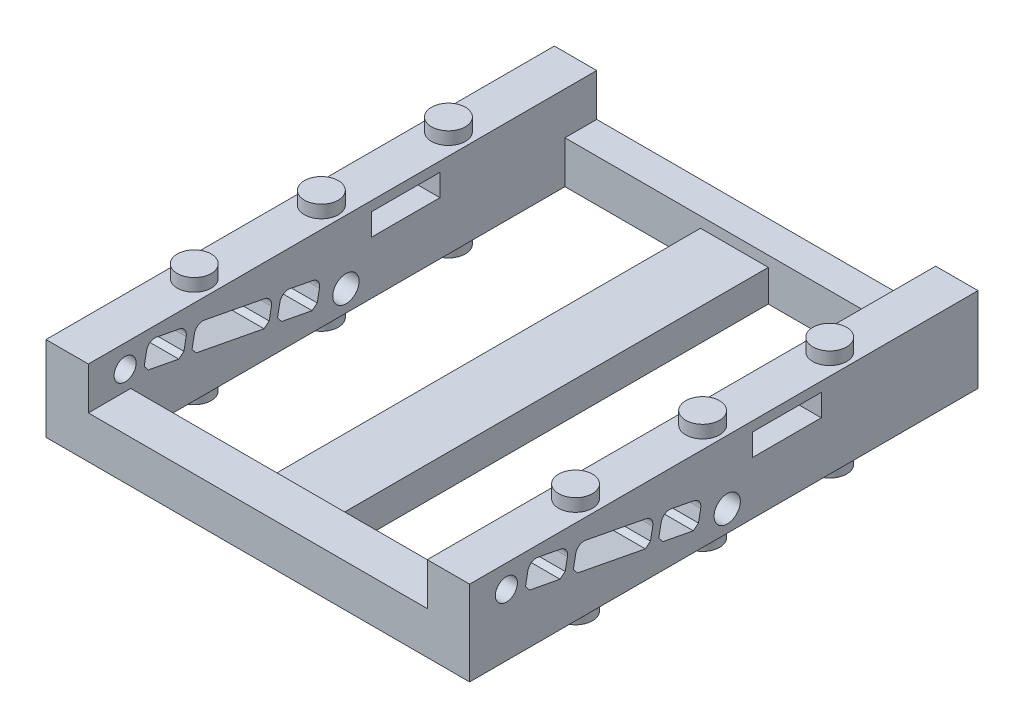
from build123d import *

# Parameters (mm, degrees)
SKETCH1_W               = 100
SKETCH1_H               = 120
SKETCH1_W_2             = 80
SKETCH1_H_2             = 102.5
BOSS_EXTRUDE1_DEPTH     = 20
SKETCH2_R               = 4
BOSS_EXTRUDE2_DEPTH     = 3
MIRROR2_COPY_1_SKETCH_R = 4
MIRROR2_COPY_1_DEPTH    = 3
SKETCH8_W               = 80
SKETCH8_H               = 10
CUT_EXTRUDE5_DEPTH      = 133.018938035
SKETCH12_R              = 3.1
SKETCH12_R_2            = 2.6
CUT_EXTRUDE7_DEPTH      = 14
SKETCH15_W              = 16
SKETCH15_H              = 7.5
BOSS_EXTRUDE4_DEPTH     = 102.5
SKETCH18_W              = 16.2
SKETCH18_H              = 5.2
CUT_EXTRUDE10_DEPTH     = 119.865470175


with BuildPart() as part:
    # Sketch1 → Boss-Extrude1 (new body)
    with BuildSketch(Plane(origin=(0, 0, 0), x_dir=(1, 0, 0), z_dir=(0, 1, 0))):
        Rectangle(SKETCH1_W, SKETCH1_H)
        with Locations((0, 1.25)):
            Rectangle(SKETCH1_W_2, SKETCH1_H_2, mode=Mode.SUBTRACT)
    extrude(amount=BOSS_EXTRUDE1_DEPTH)

    # Sketch2 → Boss-Extrude2 (add)
    with BuildSketch(Plane(origin=(0, 20, 0), x_dir=(1, 0, 0), z_dir=(0, 1, 0))):
        with Locations(Location((-45, 30, 0), (0, 0, 270))):
            Circle(SKETCH2_R)
        with Locations(Location((-45, 0, 0), (0, 0, 270))):
            Circle(SKETCH2_R)
        with Locations(Location((-45, -30, 0), (0, 0, 270))):
            Circle(SKETCH2_R)
    boss_extrude2 = extrude(amount=BOSS_EXTRUDE2_DEPTH)

    # Mirror1: Boss-Extrude2 across plane
    add(boss_extrude2.mirror(Plane(origin=(0, 0, 0), x_dir=(0, 0, 1), z_dir=(1, 0, 0))))

    # Mirror2: Boss-Extrude2 across plane
    add(boss_extrude2.mirror(Plane.ZX.offset(10)))

    # Mirror2 copy 1 sketch → Mirror2 copy 1 (add)
    with BuildSketch(Plane(origin=(0, 0, 0), x_dir=(-1, 0, 0), z_dir=(0, -1, 0))):
        with Locations(Location((-45, 30, 0), (0, 0, 270))):
            Circle(MIRROR2_COPY_1_SKETCH_R)
        with Locations(Location((-45, 0, 0), (0, 0, 270))):
            Circle(MIRROR2_COPY_1_SKETCH_R)
        with Locations(Location((-45, -30, 0), (0, 0, 270))):
            Circle(MIRROR2_COPY_1_SKETCH_R)
    extrude(amount=MIRROR2_COPY_1_DEPTH)

    # Sketch8 → Cut-Extrude5 (cut, through all)
    with BuildSketch(Plane.XY.offset(60)):
        with Locations((0, 15)):
            Rectangle(SKETCH8_W, SKETCH8_H)
    extrude(amount=-CUT_EXTRUDE5_DEPTH, mode=Mode.SUBTRACT)

    # Sketch12 → Cut-Extrude7 (cut)
    with BuildSketch(Plane.ZY.offset(50)):
        with Locations((-0.798318999, 5)):
            Circle(SKETCH12_R)
        with Locations((51.32703264, 14.597276518)):
            Circle(SKETCH12_R_2)
        with BuildLine():
            Line((38.653830619, 10.332015619), (37.447119302, 11.313913997))
            Line((37.447119302, 11.313913997), (36.917785712, 14.071821507))
            ThreePointArc((36.917785712, 14.071821507), (37.226502949, 15.57110114), (38.504949796, 16.412955884))
            Line((38.504949796, 16.412955884), (43.90636018, 17.449665035))
            ThreePointArc((43.90636018, 17.449665035), (45.405639813, 17.140947797), (46.247494557, 15.86250095))
            Line((46.247494557, 15.86250095), (46.812972275, 12.916277104))
            Line((46.812972275, 12.916277104), (45.831073897, 11.709565788))
            Line((45.831073897, 11.709565788), (38.653830619, 10.332015619))
        make_face()
        with BuildLine():
            Line((35.5191142, 10.748612516), (34.953636481, 13.694836362))
            ThreePointArc((34.953636481, 13.694836362), (34.111781738, 14.973283209), (32.612502105, 15.282000446))
            Line((32.612502105, 15.282000446), (18.372420183, 12.548858139))
            ThreePointArc((18.372420183, 12.548858139), (17.093973336, 11.707003396), (16.785256099, 10.207723763))
            Line((16.785256099, 10.207723763), (17.314589689, 7.449816253))
            Line((17.314589689, 7.449816253), (18.521301006, 6.467917875))
            Line((18.521301006, 6.467917875), (34.537215822, 9.5419012))
            Line((34.537215822, 9.5419012), (35.5191142, 10.748612516))
        make_face()
        with BuildLine():
            Line((15.348886072, 7.080929694), (14.783408354, 10.02715354))
            ThreePointArc((14.783408354, 10.02715354), (13.94155361, 11.305600388), (12.442273977, 11.614317625))
            Line((12.442273977, 11.614317625), (7.040863593, 10.577608474))
            ThreePointArc((7.040863593, 10.577608474), (5.762416746, 9.735753731), (5.453699508, 8.236474098))
            Line((5.453699508, 8.236474098), (5.983033099, 5.478566587))
            Line((5.983033099, 5.478566587), (7.189744415, 4.496668209))
            Line((7.189744415, 4.496668209), (14.366987694, 5.874218378))
            Line((14.366987694, 5.874218378), (15.348886072, 7.080929694))
        make_face()
    cut_extrude7 = extrude(amount=-CUT_EXTRUDE7_DEPTH, mode=Mode.SUBTRACT)

    # Mirror5: Cut-Extrude7 across plane
    add(cut_extrude7.mirror(Plane(origin=(0, 0, 0), x_dir=(0, 0, 1), z_dir=(1, 0, 0))), mode=Mode.SUBTRACT)

    # Sketch15 → Boss-Extrude4 (add)
    with BuildSketch(Plane(origin=(0, 0, 50), x_dir=(-1, 0, 0), z_dir=(0, 0, -1))):
        with Locations((0, 3.75)):
            Rectangle(SKETCH15_W, SKETCH15_H)
    extrude(amount=BOSS_EXTRUDE4_DEPTH)

    # Sketch18 → Cut-Extrude10 (cut, through all)
    with BuildSketch(Plane(origin=(50, 0, 0), x_dir=(0, 0, -1), z_dir=(1, 0, 0))):
        with Locations((14.9, 15.1)):
            Rectangle(SKETCH18_W, SKETCH18_H)
    extrude(amount=-CUT_EXTRUDE10_DEPTH, mode=Mode.SUBTRACT)


solid = part.part
